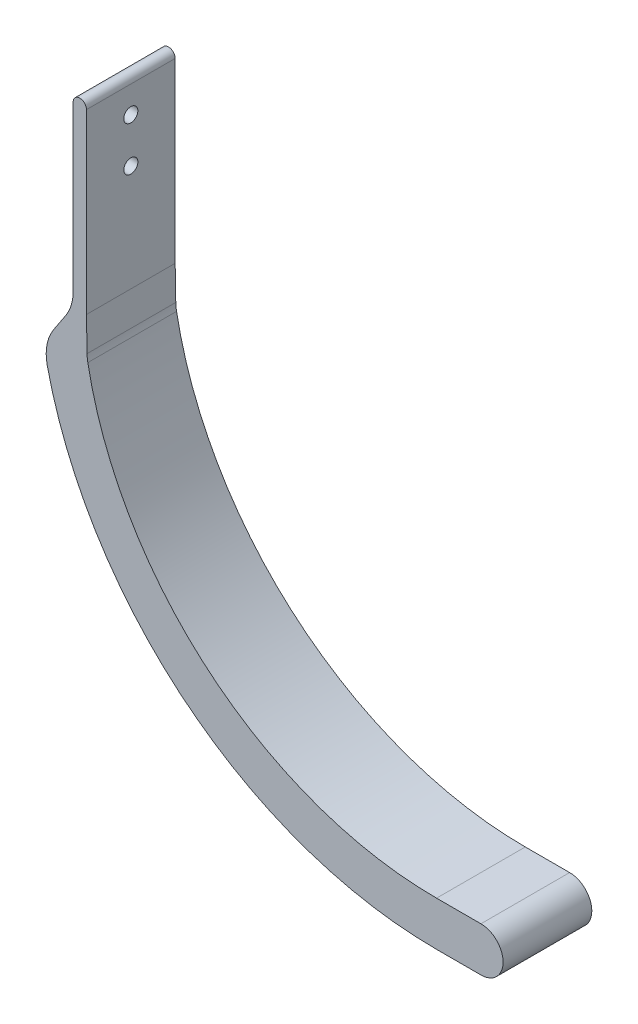
from build123d import *

# Parameters (mm, degrees)
BOSS_EXTRUDE1_DEPTH              = 20
F_1_8_0_125_DIAMETER_HOLE1_D     = 3.175
F_1_8_0_125_DIAMETER_HOLE1_DEPTH = 9.69615506
FILLET1_R                        = 10


with BuildPart() as part:
    # Sketch1 → Boss-Extrude1 (new body)
    with BuildSketch(Plane.XY.offset(20)):
        with BuildLine():
            Line((-121.03432752, -152.461637247), (-121.18624999, -144.077694208))
            Line((-121.18624999, -144.077694208), (-121.18624999, -104.077694208))
            ThreePointArc((-121.18624999, -104.077694208), (-122.68624999, -102.577694208), (-124.18624999, -104.077694208))
            Line((-124.18624999, -104.077694208), (-124.18624999, -144.077694208))
            Line((-124.18624999, -144.077694208), (-130.88240505, -154.198119024))
            ThreePointArc((-130.88240505, -154.198119024), (-100.100592151, -207.513782914), (-42.249707279, -228.569783034))
            Line((-42.249707279, -228.569783034), (-32.249707279, -228.569783034))
            ThreePointArc((-32.249707279, -228.569783034), (-27.249707279, -223.569783034), (-32.249707279, -218.569783034))
            Line((-32.249707279, -218.569783034), (-42.249707279, -218.569783034))
            ThreePointArc((-42.249707279, -218.569783034), (-93.672716054, -199.853338483), (-121.03432752, -152.461637247))
        make_face()
    extrude(amount=-BOSS_EXTRUDE1_DEPTH)

    # 1/8 (0.125) Diameter Hole1
    with Locations(Plane(origin=(-121.18624999, 0, 0), x_dir=(0, 0, -1), z_dir=(1, 0, 0))):
        with Locations((-10, -120.077694208), (-10, -110.077694208)):
            Hole(F_1_8_0_125_DIAMETER_HOLE1_D / 2, depth=F_1_8_0_125_DIAMETER_HOLE1_DEPTH)

    # Fillet1
    fillet1_edges = [part.edges().sort_by_distance(p)[0] for p in [
        (-130.88240505, -154.198119024, 10),
        (-124.18624999, -144.077694208, 10),
        (-121.03432752, -152.461637247, 10),
    ]]
    fillet(fillet1_edges, radius=FILLET1_R)


solid = part.part
